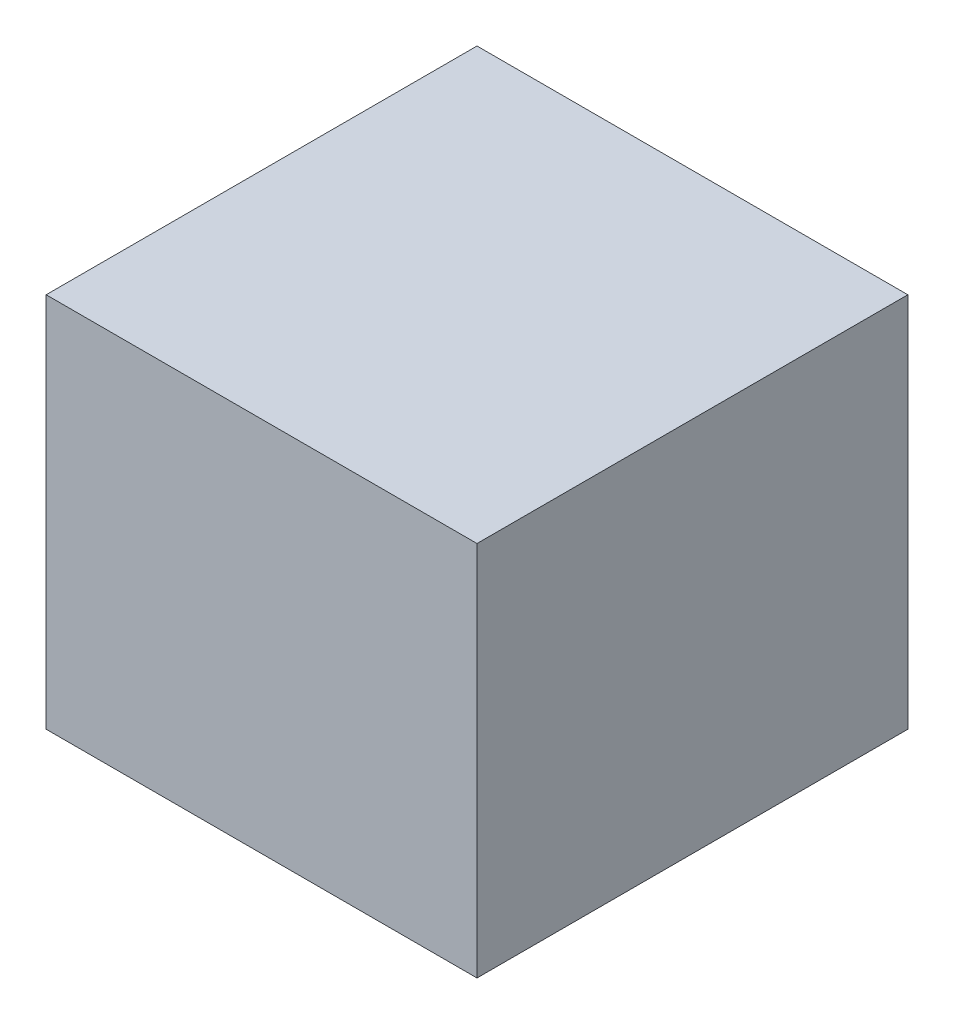
from build123d import *

# Parameters (mm, degrees)
SKETCH1_W           = 38.1
SKETCH1_H           = 33.274
BOSS_EXTRUDE1_DEPTH = 38.1


with BuildPart() as part:
    # Sketch1 → Boss-Extrude1 (new body)
    with BuildSketch(Plane.XY):
        with Locations((19.05, 16.637)):
            Rectangle(SKETCH1_W, SKETCH1_H)
    extrude(amount=-BOSS_EXTRUDE1_DEPTH)


solid = part.part
